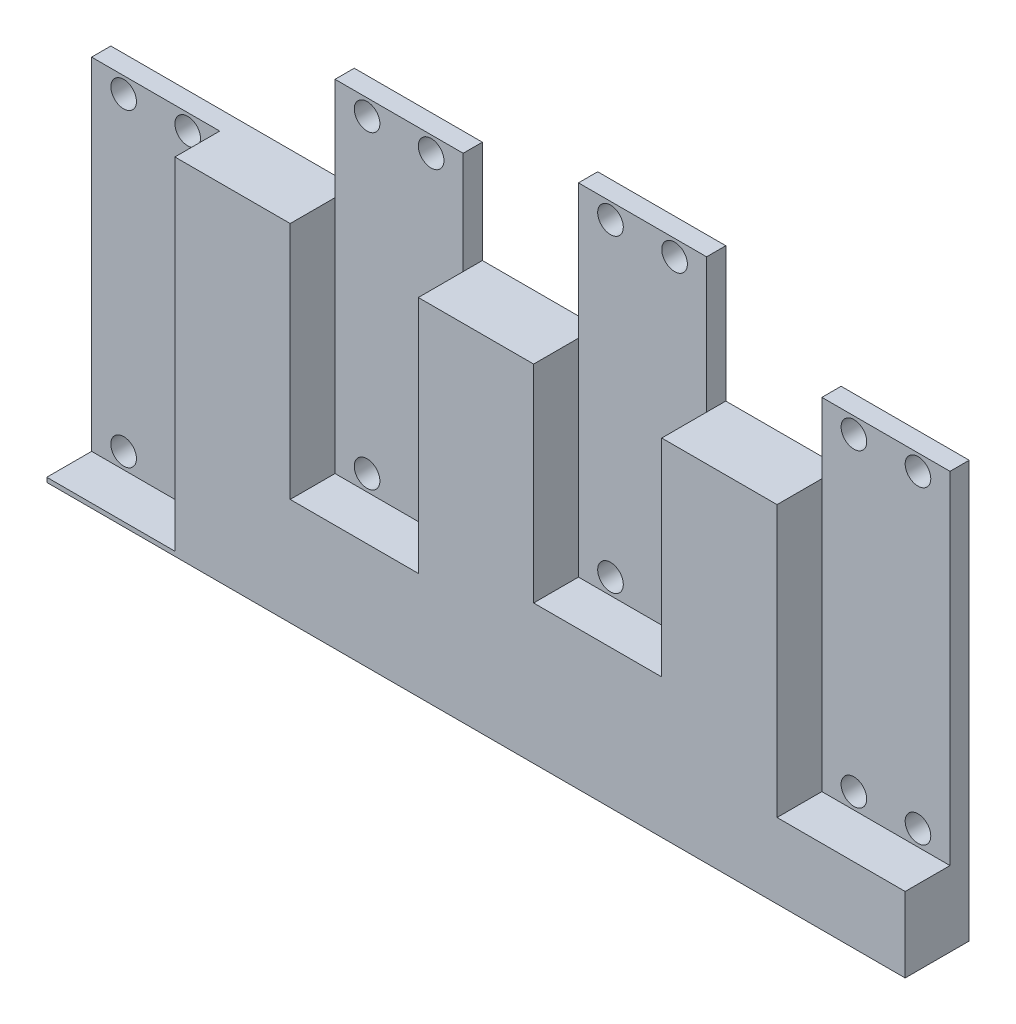
from build123d import *

# Parameters (mm, degrees)
BOSS_EXTRUDE1_DEPTH = 10
CUT_EXTRUDE1_REACH  = 89.704
SKETCH3_R           = 2
SKETCH3_11_W        = 20
SKETCH3_11_H        = 53.3
SKETCH3_11_R        = 2
CUT_EXTRUDE2_DEPTH  = 7
CUT_EXTRUDE3_REACH  = 89.704
SKETCH4_W           = 9
SKETCH4_H           = 16.003442502
SKETCH4_W_2         = 18
SKETCH4_H_2         = 21
SKETCH4_H_3         = 21.24342545


with BuildPart() as part:
    # Sketch1 → Boss-Extrude1 (new body)
    with BuildSketch(Plane.XY):
        Polygon((-31, 25), (-60, 25), (-60, -29), (74, -29), (74, 36), (45, 36), (45, 46), (7, 46), (7, 41), (-31, 41), align=None)
    extrude(amount=BOSS_EXTRUDE1_DEPTH)

    # Sketch3 → Cut-Extrude1 (cut, up to next)
    with BuildSketch(Plane.XY.offset(10), mode=Mode.PRIVATE) as cut_extrude1_sk1:
        with Locations((-55, 22.5)):
            Circle(SKETCH3_R)
    cut_extrude1_tool1 = extrude(cut_extrude1_sk1.sketch, amount=-CUT_EXTRUDE1_REACH, mode=Mode.PRIVATE) & part.part
    # Sketch3 → Cut-Extrude1 (cut, up to next)
    with BuildSketch(Plane.XY.offset(10), mode=Mode.PRIVATE) as cut_extrude1_sk2:
        with Locations((-17, 38.5)):
            Circle(SKETCH3_R)
    cut_extrude1_tool2 = extrude(cut_extrude1_sk2.sketch, amount=-CUT_EXTRUDE1_REACH, mode=Mode.PRIVATE) & part.part
    # Sketch3 → Cut-Extrude1 (cut, up to next)
    with BuildSketch(Plane.XY.offset(10), mode=Mode.PRIVATE) as cut_extrude1_sk3:
        with Locations((21, 43.5)):
            Circle(SKETCH3_R)
    cut_extrude1_tool3 = extrude(cut_extrude1_sk3.sketch, amount=-CUT_EXTRUDE1_REACH, mode=Mode.PRIVATE) & part.part
    # Sketch3 → Cut-Extrude1 (cut, up to next)
    with BuildSketch(Plane.XY.offset(10), mode=Mode.PRIVATE) as cut_extrude1_sk4:
        with Locations((59, 33.5)):
            Circle(SKETCH3_R)
    cut_extrude1_tool4 = extrude(cut_extrude1_sk4.sketch, amount=-CUT_EXTRUDE1_REACH, mode=Mode.PRIVATE) & part.part
    # Sketch3 → Cut-Extrude1 (cut, up to next)
    with BuildSketch(Plane.XY.offset(10), mode=Mode.PRIVATE) as cut_extrude1_sk5:
        with Locations((-45, 22.5)):
            Circle(SKETCH3_R)
    cut_extrude1_tool5 = extrude(cut_extrude1_sk5.sketch, amount=-CUT_EXTRUDE1_REACH, mode=Mode.PRIVATE) & part.part
    # Sketch3 → Cut-Extrude1 (cut, up to next)
    with BuildSketch(Plane.XY.offset(10), mode=Mode.PRIVATE) as cut_extrude1_sk6:
        with Locations((-45, -25.8)):
            Circle(SKETCH3_R)
    cut_extrude1_tool6 = extrude(cut_extrude1_sk6.sketch, amount=-CUT_EXTRUDE1_REACH, mode=Mode.PRIVATE) & part.part
    # Sketch3 → Cut-Extrude1 (cut, up to next)
    with BuildSketch(Plane.XY.offset(10), mode=Mode.PRIVATE) as cut_extrude1_sk7:
        with Locations((-55, -25.8)):
            Circle(SKETCH3_R)
    cut_extrude1_tool7 = extrude(cut_extrude1_sk7.sketch, amount=-CUT_EXTRUDE1_REACH, mode=Mode.PRIVATE) & part.part
    # Sketch3 → Cut-Extrude1 (cut, up to next)
    with BuildSketch(Plane.XY.offset(10), mode=Mode.PRIVATE) as cut_extrude1_sk8:
        with Locations((-7, 38.5)):
            Circle(SKETCH3_R)
    cut_extrude1_tool8 = extrude(cut_extrude1_sk8.sketch, amount=-CUT_EXTRUDE1_REACH, mode=Mode.PRIVATE) & part.part
    # Sketch3 → Cut-Extrude1 (cut, up to next)
    with BuildSketch(Plane.XY.offset(10), mode=Mode.PRIVATE) as cut_extrude1_sk9:
        with Locations((-7, -9.8)):
            Circle(SKETCH3_R)
    cut_extrude1_tool9 = extrude(cut_extrude1_sk9.sketch, amount=-CUT_EXTRUDE1_REACH, mode=Mode.PRIVATE) & part.part
    # Sketch3 → Cut-Extrude1 (cut, up to next)
    with BuildSketch(Plane.XY.offset(10), mode=Mode.PRIVATE) as cut_extrude1_sk10:
        with Locations((-17, -9.8)):
            Circle(SKETCH3_R)
    cut_extrude1_tool10 = extrude(cut_extrude1_sk10.sketch, amount=-CUT_EXTRUDE1_REACH, mode=Mode.PRIVATE) & part.part
    # Sketch3 → Cut-Extrude1 (cut, up to next)
    with BuildSketch(Plane.XY.offset(10), mode=Mode.PRIVATE) as cut_extrude1_sk11:
        with Locations((31, 43.5)):
            Circle(SKETCH3_R)
    cut_extrude1_tool11 = extrude(cut_extrude1_sk11.sketch, amount=-CUT_EXTRUDE1_REACH, mode=Mode.PRIVATE) & part.part
    # Sketch3 → Cut-Extrude1 (cut, up to next)
    with BuildSketch(Plane.XY.offset(10), mode=Mode.PRIVATE) as cut_extrude1_sk12:
        with Locations((31, -4.8)):
            Circle(SKETCH3_R)
    cut_extrude1_tool12 = extrude(cut_extrude1_sk12.sketch, amount=-CUT_EXTRUDE1_REACH, mode=Mode.PRIVATE) & part.part
    # Sketch3 → Cut-Extrude1 (cut, up to next)
    with BuildSketch(Plane.XY.offset(10), mode=Mode.PRIVATE) as cut_extrude1_sk13:
        with Locations((21, -4.8)):
            Circle(SKETCH3_R)
    cut_extrude1_tool13 = extrude(cut_extrude1_sk13.sketch, amount=-CUT_EXTRUDE1_REACH, mode=Mode.PRIVATE) & part.part
    # Sketch3 → Cut-Extrude1 (cut, up to next)
    with BuildSketch(Plane.XY.offset(10), mode=Mode.PRIVATE) as cut_extrude1_sk14:
        with Locations((69, 33.5)):
            Circle(SKETCH3_R)
    cut_extrude1_tool14 = extrude(cut_extrude1_sk14.sketch, amount=-CUT_EXTRUDE1_REACH, mode=Mode.PRIVATE) & part.part
    # Sketch3 → Cut-Extrude1 (cut, up to next)
    with BuildSketch(Plane.XY.offset(10), mode=Mode.PRIVATE) as cut_extrude1_sk15:
        with Locations((69, -14.8)):
            Circle(SKETCH3_R)
    cut_extrude1_tool15 = extrude(cut_extrude1_sk15.sketch, amount=-CUT_EXTRUDE1_REACH, mode=Mode.PRIVATE) & part.part
    # Sketch3 → Cut-Extrude1 (cut, up to next)
    with BuildSketch(Plane.XY.offset(10), mode=Mode.PRIVATE) as cut_extrude1_sk16:
        with Locations((59, -14.8)):
            Circle(SKETCH3_R)
    cut_extrude1_tool16 = extrude(cut_extrude1_sk16.sketch, amount=-CUT_EXTRUDE1_REACH, mode=Mode.PRIVATE) & part.part
    add(cut_extrude1_tool1.solids().sort_by_distance((-55, 22.5, 10))[0], mode=Mode.SUBTRACT)
    add(cut_extrude1_tool2.solids().sort_by_distance((-17, 38.5, 10))[0], mode=Mode.SUBTRACT)
    add(cut_extrude1_tool3.solids().sort_by_distance((21, 43.5, 10))[0], mode=Mode.SUBTRACT)
    add(cut_extrude1_tool4.solids().sort_by_distance((59, 33.5, 10))[0], mode=Mode.SUBTRACT)
    add(cut_extrude1_tool5.solids().sort_by_distance((-45, 22.5, 10))[0], mode=Mode.SUBTRACT)
    add(cut_extrude1_tool6.solids().sort_by_distance((-45, -25.8, 10))[0], mode=Mode.SUBTRACT)
    add(cut_extrude1_tool7.solids().sort_by_distance((-55, -25.8, 10))[0], mode=Mode.SUBTRACT)
    add(cut_extrude1_tool8.solids().sort_by_distance((-7, 38.5, 10))[0], mode=Mode.SUBTRACT)
    add(cut_extrude1_tool9.solids().sort_by_distance((-7, -9.8, 10))[0], mode=Mode.SUBTRACT)
    add(cut_extrude1_tool10.solids().sort_by_distance((-17, -9.8, 10))[0], mode=Mode.SUBTRACT)
    add(cut_extrude1_tool11.solids().sort_by_distance((31, 43.5, 10))[0], mode=Mode.SUBTRACT)
    add(cut_extrude1_tool12.solids().sort_by_distance((31, -4.8, 10))[0], mode=Mode.SUBTRACT)
    add(cut_extrude1_tool13.solids().sort_by_distance((21, -4.8, 10))[0], mode=Mode.SUBTRACT)
    add(cut_extrude1_tool14.solids().sort_by_distance((69, 33.5, 10))[0], mode=Mode.SUBTRACT)
    add(cut_extrude1_tool15.solids().sort_by_distance((69, -14.8, 10))[0], mode=Mode.SUBTRACT)
    add(cut_extrude1_tool16.solids().sort_by_distance((59, -14.8, 10))[0], mode=Mode.SUBTRACT)

    # Sketch3<11> → Cut-Extrude2 (cut)
    # profile 1 of 4: a face of its own
    with BuildSketch(Plane.XY.offset(10)):
        with Locations((-50, -1.65)):
            Rectangle(SKETCH3_11_W, SKETCH3_11_H)
        with Locations((-55, 22.5)):
            Circle(SKETCH3_11_R, mode=Mode.SUBTRACT)
        with Locations((-45, 22.5)):
            Circle(SKETCH3_11_R, mode=Mode.SUBTRACT)
        with Locations((-55, -25.8)):
            Circle(SKETCH3_11_R, mode=Mode.SUBTRACT)
        with Locations((-45, -25.8)):
            Circle(SKETCH3_11_R, mode=Mode.SUBTRACT)
    # profile 2 of 4: a face of its own
    with BuildSketch(Plane.XY.offset(10)):
        with Locations((-12, 14.35)):
            Rectangle(SKETCH3_11_W, SKETCH3_11_H)
        with Locations((-17, 38.5)):
            Circle(SKETCH3_11_R, mode=Mode.SUBTRACT)
        with Locations((-17, -9.8)):
            Circle(SKETCH3_11_R, mode=Mode.SUBTRACT)
        with Locations((-7, 38.5)):
            Circle(SKETCH3_11_R, mode=Mode.SUBTRACT)
        with Locations((-7, -9.8)):
            Circle(SKETCH3_11_R, mode=Mode.SUBTRACT)
    # profile 3 of 4: a face of its own
    with BuildSketch(Plane.XY.offset(10)):
        with Locations((26, 19.35)):
            Rectangle(SKETCH3_11_W, SKETCH3_11_H)
        with Locations((21, 43.5)):
            Circle(SKETCH3_11_R, mode=Mode.SUBTRACT)
        with Locations((21, -4.8)):
            Circle(SKETCH3_11_R, mode=Mode.SUBTRACT)
        with Locations((31, 43.5)):
            Circle(SKETCH3_11_R, mode=Mode.SUBTRACT)
        with Locations((31, -4.8)):
            Circle(SKETCH3_11_R, mode=Mode.SUBTRACT)
    # profile 4 of 4: a face of its own
    with BuildSketch(Plane.XY.offset(10)):
        with Locations((64, 9.35)):
            Rectangle(SKETCH3_11_W, SKETCH3_11_H)
        with Locations((59, 33.5)):
            Circle(SKETCH3_11_R, mode=Mode.SUBTRACT)
        with Locations((59, -14.8)):
            Circle(SKETCH3_11_R, mode=Mode.SUBTRACT)
        with Locations((69, 33.5)):
            Circle(SKETCH3_11_R, mode=Mode.SUBTRACT)
        with Locations((69, -14.8)):
            Circle(SKETCH3_11_R, mode=Mode.SUBTRACT)
    extrude(amount=-CUT_EXTRUDE2_DEPTH, mode=Mode.SUBTRACT)

    # Sketch4 → Cut-Extrude3 (cut, up to next)
    with BuildSketch(Plane.XY.offset(10), mode=Mode.PRIVATE) as cut_extrude3_sk1:
        with Locations((-26.5, 33.001721251)):
            Rectangle(SKETCH4_W, SKETCH4_H)
    cut_extrude3_tool1 = extrude(cut_extrude3_sk1.sketch, amount=-CUT_EXTRUDE3_REACH, mode=Mode.PRIVATE) & part.part
    # Sketch4 → Cut-Extrude3 (cut, up to next)
    with BuildSketch(Plane.XY.offset(10), mode=Mode.PRIVATE) as cut_extrude3_sk2:
        with Locations((7, 35.5)):
            Rectangle(SKETCH4_W_2, SKETCH4_H_2)
    cut_extrude3_tool2 = extrude(cut_extrude3_sk2.sketch, amount=-CUT_EXTRUDE3_REACH, mode=Mode.PRIVATE) & part.part
    # Sketch4 → Cut-Extrude3 (cut, up to next)
    with BuildSketch(Plane.XY.offset(10), mode=Mode.PRIVATE) as cut_extrude3_sk3:
        with Locations((45, 35.621712725)):
            Rectangle(SKETCH4_W_2, SKETCH4_H_3)
    cut_extrude3_tool3 = extrude(cut_extrude3_sk3.sketch, amount=-CUT_EXTRUDE3_REACH, mode=Mode.PRIVATE) & part.part
    add(cut_extrude3_tool1.solids().sort_by_distance((-26.5, 33.001721, 10))[0], mode=Mode.SUBTRACT)
    add(cut_extrude3_tool2.solids().sort_by_distance((7, 35.5, 10))[0], mode=Mode.SUBTRACT)
    add(cut_extrude3_tool3.solids().sort_by_distance((45, 35.621713, 10))[0], mode=Mode.SUBTRACT)


solid = part.part
